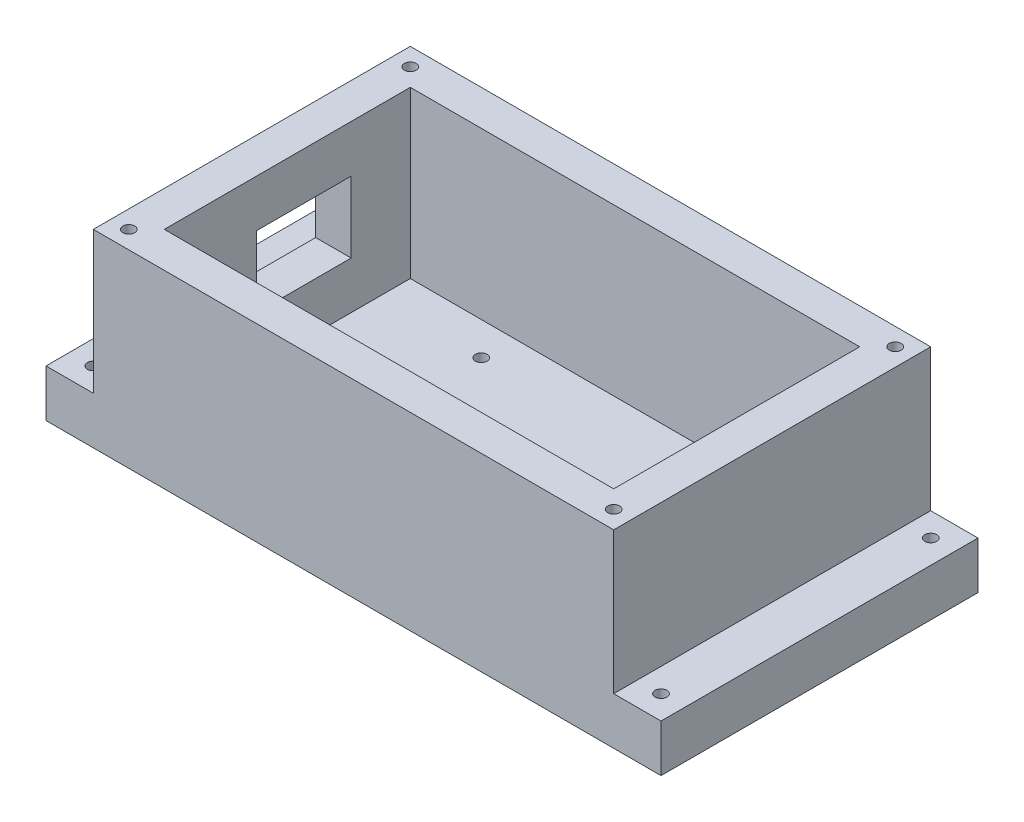
from build123d import *

# Parameters (mm, degrees)
SKETCH1_W           = 165.1
SKETCH1_H           = 85.09
BOSS_EXTRUDE2_DEPTH = 12.7
SKETCH3_W           = 139.7
SKETCH3_H           = 85.09
BOSS_EXTRUDE3_DEPTH = 38.1
SKETCH4_W           = 120.65
SKETCH4_H           = 66.04
CUT_EXTRUDE1_DEPTH  = 44.45
SKETCH5_R           = 1.5875
CUT_EXTRUDE3_DEPTH  = 154.98717268
SKETCH8_R           = 1.5875
CUT_EXTRUDE4_DEPTH  = 25.4
SKETCH11_R          = 1.5875
CUT_EXTRUDE6_DEPTH  = 153.275595057
CUT_EXTRUDE7_DEPTH  = 3.175
CUT_EXTRUDE8_REACH  = 176.92
SKETCH15_W          = 25.4
SKETCH15_H          = 19.05


with BuildPart() as part:
    # Sketch1 → Boss-Extrude2 (new body)
    with BuildSketch(Plane(origin=(0, 0, 0), x_dir=(1, 0, 0), z_dir=(0, 1, 0))):
        with Locations((47.625, 26.67)):
            Rectangle(SKETCH1_W, SKETCH1_H)
    extrude(amount=BOSS_EXTRUDE2_DEPTH)

    # Sketch3 → Boss-Extrude3 (add)
    with BuildSketch(Plane(origin=(0, 12.7, 0), x_dir=(1, 0, 0), z_dir=(0, 1, 0))):
        with Locations((47.625, 26.67)):
            Rectangle(SKETCH3_W, SKETCH3_H)
    extrude(amount=BOSS_EXTRUDE3_DEPTH)

    # Sketch4 → Cut-Extrude1 (cut)
    with BuildSketch(Plane(origin=(0, 50.8, 0), x_dir=(1, 0, 0), z_dir=(0, 1, 0))):
        with Locations((47.625, 26.67)):
            Rectangle(SKETCH4_W, SKETCH4_H)
    extrude(amount=-CUT_EXTRUDE1_DEPTH, mode=Mode.SUBTRACT)

    # Sketch5 → Cut-Extrude3 (cut, through all)
    with BuildSketch(Plane(origin=(0, 6.35, 0), x_dir=(1, 0, 0), z_dir=(0, 1, 0))):
        with Locations(Location((15.24, 50.8, 0), (0, 0, 270))):
            Circle(SKETCH5_R)
        with Locations(Location((13.97, 2.54, 0), (0, 0, 270))):
            Circle(SKETCH5_R)
        with Locations(Location((90.17, 50.8, 0), (0, 0, 270))):
            Circle(SKETCH5_R)
        with Locations(Location((96.52, 2.54, 0), (0, 0, 270))):
            Circle(SKETCH5_R)
    extrude(amount=-CUT_EXTRUDE3_DEPTH, mode=Mode.SUBTRACT)

    # Sketch8 → Cut-Extrude4 (cut)
    with BuildSketch(Plane(origin=(0, 50.8, 0), x_dir=(1, 0, 0), z_dir=(0, 1, 0))):
        with Locations(Location((-17.4625, 64.4525, 0), (0, 0, 270))):
            Circle(SKETCH8_R)
        with Locations(Location((-17.4625, -11.1125, 0), (0, 0, 270))):
            Circle(SKETCH8_R)
        with Locations(Location((112.7125, -11.1125, 0), (0, 0, 270))):
            Circle(SKETCH8_R)
        with Locations(Location((112.7125, 64.4525, 0), (0, 0, 270))):
            Circle(SKETCH8_R)
    extrude(amount=-CUT_EXTRUDE4_DEPTH, mode=Mode.SUBTRACT)

    # Sketch11 → Cut-Extrude6 (cut, through all)
    with BuildSketch(Plane(origin=(0, 12.7, 0), x_dir=(1, 0, 0), z_dir=(0, 1, 0))):
        with Locations(Location((-28.575, 62.865, 0), (0, 0, 270))):
            Circle(SKETCH11_R)
        with Locations(Location((-28.575, -9.525, 0), (0, 0, 270))):
            Circle(SKETCH11_R)
        with Locations(Location((123.825, -9.525, 0), (0, 0, 270))):
            Circle(SKETCH11_R)
        with Locations(Location((123.825, 62.865, 0), (0, 0, 270))):
            Circle(SKETCH11_R)
    extrude(amount=-CUT_EXTRUDE6_DEPTH, mode=Mode.SUBTRACT)

    # Sketch14 → Cut-Extrude7 (cut)
    with BuildSketch(Plane.XZ):
        Polygon((17.057033947, -1.79780972), (14.870761336, 0.50454496), (11.783727389, -0.23764532), (10.882966053, -3.28219028), (13.069238664, -5.58454496), (16.156272611, -4.84235468), align=None)
        Polygon((18.415, -50.8), (16.8275, -48.050369343), (13.6525, -48.050369343), (12.065, -50.8), (13.6525, -53.549630657), (16.8275, -53.549630657), align=None)
        Polygon((93.009008497, -52.221497715), (92.820557381, -49.052095378), (89.981548884, -47.630597662), (87.330991503, -49.378502285), (87.519442619, -52.547904622), (90.358451116, -53.969402338), align=None)
        Polygon((99.581036114, -3.383020112), (98.78059489, -0.310575019), (95.719558776, 0.532445092), (93.458963886, -1.696979888), (94.25940511, -4.769424981), (97.320441224, -5.612445092), align=None)
    extrude(amount=-CUT_EXTRUDE7_DEPTH, mode=Mode.SUBTRACT)

    # Sketch15 → Cut-Extrude8 (cut, up to next)
    with BuildSketch(Plane.ZY.offset(22.225), mode=Mode.PRIVATE) as cut_extrude8_sk1:
        with Locations((-31.115, 28.575)):
            Rectangle(SKETCH15_W, SKETCH15_H)
    cut_extrude8_tool1 = extrude(cut_extrude8_sk1.sketch, amount=-CUT_EXTRUDE8_REACH, mode=Mode.PRIVATE) & part.part
    add(cut_extrude8_tool1.solids().sort_by_distance((-22.225, 28.575, -31.115))[0], mode=Mode.SUBTRACT)


solid = part.part
